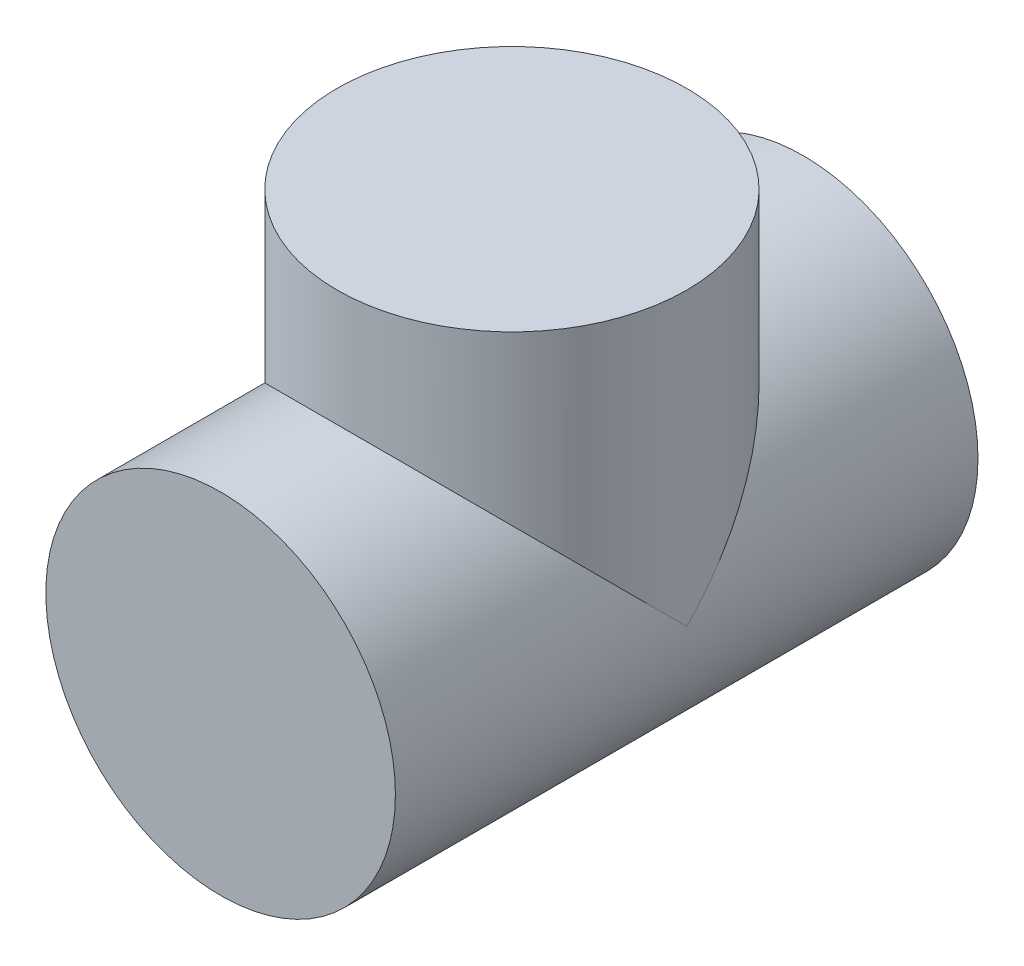
from build123d import *

# Parameters (mm, degrees)
SKETCH1_R           = 7.62
BOSS_EXTRUDE1_DEPTH = 25.4
SKETCH2_R           = 7.62
BOSS_EXTRUDE2_DEPTH = 12.7


with BuildPart() as part:
    # Sketch1 → Boss-Extrude1 (new body)
    with BuildSketch(Plane.XY):
        Circle(SKETCH1_R)
    extrude(amount=BOSS_EXTRUDE1_DEPTH)

    # Sketch2 → Boss-Extrude2 (add)
    with BuildSketch(Plane(origin=(0, 0, 0), x_dir=(1, 0, 0), z_dir=(0, 1, 0))):
        with Locations((0, -12.7)):
            Circle(SKETCH2_R)
    extrude(amount=BOSS_EXTRUDE2_DEPTH)


solid = part.part
